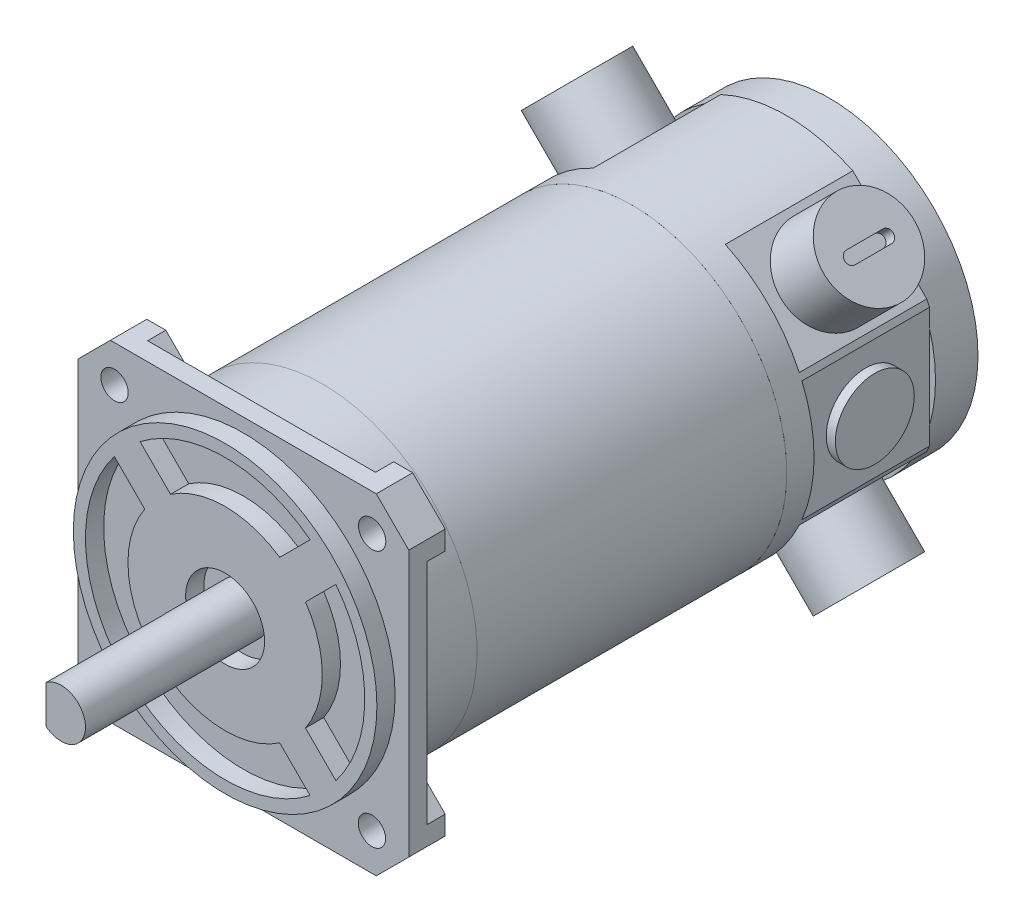
from build123d import *

# Parameters (mm, degrees)
SKETCH1_W            = 54.5
SKETCH1_H            = 54.5
BOSS_EXTRUDE1_DEPTH  = 3
SKETCH2_R            = 2.25
CUT_EXTRUDE1_DEPTH   = 3
SKETCH2_3_R          = 25
SKETCH2_3_R_2        = 23
SKETCH2_3_R_3        = 16
SKETCH2_3_R_4        = 6.5
BOSS_EXTRUDE2_DEPTH  = 3
SKETCH3_R            = 4
BOSS_EXTRUDE3_DEPTH  = 30
CUT_EXTRUDE2_DEPTH   = 20
SKETCH5_R            = 2.25
BOSS_EXTRUDE4_DEPTH  = 3
SKETCH5_3_R          = 25.5
SKETCH5_3_R_2        = 18.5
BOSS_EXTRUDE5_DEPTH  = 10
SKETCH6_R            = 25.5
SKETCH6_R_2          = 18.5
BOSS_EXTRUDE6_DEPTH  = 51
SKETCH7_R            = 18.5
BOSS_EXTRUDE7_DEPTH  = 4.5
BOSS_EXTRUDE8_START  = 4.5
SKETCH7_3_R          = 18.5
BOSS_EXTRUDE8_DEPTH  = 21
SKETCH8_R            = 24.5
BOSS_EXTRUDE9_DEPTH  = 7
SKETCH9_R            = 12.5
BOSS_EXTRUDE10_DEPTH = 8
SKETCH10_R           = 6.5
SKETCH10_R_2         = 3
CUT_EXTRUDE3_DEPTH   = 3
SKETCH10_2_R         = 3
BOSS_EXTRUDE11_DEPTH = 4
SKETCH11_R           = 7.5
BOSS_EXTRUDE12_DEPTH = 10
CUT_EXTRUDE4_DEPTH   = 2
CIRPATTERN2_COUNT    = 4
SKETCH13_R           = 8
BOSS_EXTRUDE13_DEPTH = 2
SKETCH14_R           = 6.5
BOSS_EXTRUDE14_DEPTH = 1.5


with BuildPart() as part:
    # Sketch1 → Boss-Extrude1 (new body)
    with BuildSketch(Plane.XY):
        Rectangle(SKETCH1_W, SKETCH1_H)
    extrude(amount=BOSS_EXTRUDE1_DEPTH)

    # Sketch2 → Cut-Extrude1 (cut)
    with BuildSketch(Plane.XY.offset(3)):
        Polygon((-27.25, 21.893921292), (-21.893921292, 27.25), (-27.25, 27.25), align=None)
        Polygon((27.25, 27.25), (21.893921292, 27.25), (27.25, 21.893921292), align=None)
        Polygon((-21.893921292, -27.25), (-27.25, -21.893921292), (-27.25, -27.25), align=None)
        Polygon((27.25, -27.25), (27.25, -21.893921292), (21.893921292, -27.25), align=None)
        with Locations((-21.213203436, -21.213203436)):
            Circle(SKETCH2_R)
        with Locations((21.175842801, -21.175842801)):
            Circle(SKETCH2_R)
        with Locations((21.213203436, 21.213203436)):
            Circle(SKETCH2_R)
        with Locations((-21.213203436, 21.213203436)):
            Circle(SKETCH2_R)
    extrude(amount=-CUT_EXTRUDE1_DEPTH, mode=Mode.SUBTRACT)

    # Sketch2<3> → Boss-Extrude2 (add)
    # profile 1 of 6: a face of its own
    with BuildSketch(Plane.XY.offset(3)):
        with Locations(Location((0, 0, 0), (0, 0, 180))):
            Circle(SKETCH2_3_R)
        Circle(SKETCH2_3_R_2, mode=Mode.SUBTRACT)
    # profile 2 of 6: a face of its own
    with BuildSketch(Plane.XY.offset(3)):
        Circle(SKETCH2_3_R_3)
        Circle(SKETCH2_3_R_4, mode=Mode.SUBTRACT)
    # profile 3 of 6: a face of its own
    with BuildSketch(Plane.XY.offset(3)):
        with BuildLine():
            Line((14.003195153, 18.24583584), (8.991735042, 13.234375729))
            ThreePointArc((8.991735042, 13.234375729), (11.313708499, 11.313708499), (13.234375729, 8.991735042))
            Line((13.234375729, 8.991735042), (18.24583584, 14.003195153))
            ThreePointArc((18.24583584, 14.003195153), (16.263455967, 16.263455967), (14.003195153, 18.24583584))
        make_face()
    # profile 4 of 6: a face of its own
    with BuildSketch(Plane.XY.offset(3)):
        with BuildLine():
            ThreePointArc((13.234375729, -8.991735042), (11.313708499, -11.313708499), (8.991735042, -13.234375729))
            Line((8.991735042, -13.234375729), (14.003195153, -18.24583584))
            ThreePointArc((14.003195153, -18.24583584), (16.263455967, -16.263455967), (18.24583584, -14.003195153))
            Line((18.24583584, -14.003195153), (13.234375729, -8.991735042))
        make_face()
    # profile 5 of 6: a face of its own
    with BuildSketch(Plane.XY.offset(3)):
        with BuildLine():
            ThreePointArc((-8.991735042, -13.234375729), (-11.313708499, -11.313708499), (-13.234375729, -8.991735042))
            Line((-13.234375729, -8.991735042), (-18.24583584, -14.003195153))
            ThreePointArc((-18.24583584, -14.003195153), (-16.263455967, -16.263455967), (-14.003195153, -18.24583584))
            Line((-14.003195153, -18.24583584), (-8.991735042, -13.234375729))
        make_face()
    # profile 6 of 6: a face of its own
    with BuildSketch(Plane.XY.offset(3)):
        with BuildLine():
            Line((-18.24583584, 14.003195153), (-13.234375729, 8.991735042))
            ThreePointArc((-13.234375729, 8.991735042), (-11.313708499, 11.313708499), (-8.991735042, 13.234375729))
            Line((-8.991735042, 13.234375729), (-14.003195153, 18.24583584))
            ThreePointArc((-14.003195153, 18.24583584), (-16.263455967, 16.263455967), (-18.24583584, 14.003195153))
        make_face()
    extrude(amount=BOSS_EXTRUDE2_DEPTH)

    # Sketch5 → Boss-Extrude4 (add)
    # profile 1 of 4: a face of its own
    with BuildSketch(Plane(origin=(0, 0, 0), x_dir=(-1, 0, 0), z_dir=(0, 0, -1))):
        with BuildLine():
            Line((21.893921292, 27.25), (18.764718626, 27.25))
            Line((18.764718626, 27.25), (13.282341481, 21.767622855))
            ThreePointArc((13.282341481, 21.767622855), (18.03122292, 18.03122292), (21.767622855, 13.282341481))
            Line((21.767622855, 13.282341481), (27.25, 18.764718626))
            Line((27.25, 18.764718626), (27.25, 21.893921292))
            Line((27.25, 21.893921292), (21.893921292, 27.25))
        make_face()
        with Locations(Location((21.213203436, 21.213203436, 0), (0, 0, 180))):
            Circle(SKETCH5_R, mode=Mode.SUBTRACT)
    # profile 2 of 4: a face of its own
    with BuildSketch(Plane(origin=(0, 0, 0), x_dir=(-1, 0, 0), z_dir=(0, 0, -1))):
        with BuildLine():
            Line((-13.282341481, 21.767622855), (-18.764718626, 27.25))
            Line((-18.764718626, 27.25), (-21.893921292, 27.25))
            Line((-21.893921292, 27.25), (-27.25, 21.893921292))
            Line((-27.25, 21.893921292), (-27.25, 18.764718626))
            Line((-27.25, 18.764718626), (-21.767622855, 13.282341481))
            ThreePointArc((-21.767622855, 13.282341481), (-18.03122292, 18.03122292), (-13.282341481, 21.767622855))
        make_face()
        with Locations(Location((-21.213203436, 21.213203436, 0), (0, 0, 180))):
            Circle(SKETCH5_R, mode=Mode.SUBTRACT)
    # profile 3 of 4: a face of its own
    with BuildSketch(Plane(origin=(0, 0, 0), x_dir=(-1, 0, 0), z_dir=(0, 0, -1))):
        with BuildLine():
            ThreePointArc((-13.282341481, -21.767622855), (-18.03122292, -18.03122292), (-21.767622855, -13.282341481))
            Line((-21.767622855, -13.282341481), (-27.25, -18.764718626))
            Line((-27.25, -18.764718626), (-27.25, -21.893921292))
            Line((-27.25, -21.893921292), (-21.893921292, -27.25))
            Line((-21.893921292, -27.25), (-18.764718626, -27.25))
            Line((-18.764718626, -27.25), (-13.282341481, -21.767622855))
        make_face()
        with Locations(Location((-21.175842801, -21.175842801, 0), (0, 0, 180))):
            Circle(SKETCH5_R, mode=Mode.SUBTRACT)
    # profile 4 of 4: a face of its own
    with BuildSketch(Plane(origin=(0, 0, 0), x_dir=(-1, 0, 0), z_dir=(0, 0, -1))):
        with BuildLine():
            Line((27.25, -21.893921292), (27.25, -18.764718626))
            Line((27.25, -18.764718626), (21.767622855, -13.282341481))
            ThreePointArc((21.767622855, -13.282341481), (18.03122292, -18.03122292), (13.282341481, -21.767622855))
            Line((13.282341481, -21.767622855), (18.764718626, -27.25))
            Line((18.764718626, -27.25), (21.893921292, -27.25))
            Line((21.893921292, -27.25), (27.25, -21.893921292))
        make_face()
        with Locations(Location((21.213203436, -21.213203436, 0), (0, 0, 180))):
            Circle(SKETCH5_R, mode=Mode.SUBTRACT)
    extrude(amount=BOSS_EXTRUDE4_DEPTH)

    # Sketch5<3> → Boss-Extrude5 (add)
    with BuildSketch(Plane(origin=(0, 0, 0), x_dir=(-1, 0, 0), z_dir=(0, 0, -1))):
        with Locations(Location((0, 0, 0), (0, 0, 148.608960631))):
            Circle(SKETCH5_3_R)
        Circle(SKETCH5_3_R_2, mode=Mode.SUBTRACT)
    extrude(amount=BOSS_EXTRUDE5_DEPTH)


with BuildPart() as body_2:
    # Sketch3 → Boss-Extrude3 (new body)
    with BuildSketch(Plane.XY.offset(3)):
        Circle(SKETCH3_R)
    extrude(amount=BOSS_EXTRUDE3_DEPTH)

    # Sketch4 → Cut-Extrude2 (cut)
    with BuildSketch(Plane.XY.offset(33)):
        with BuildLine():
            Line((-2.5, 3.122498999), (-2.5, -3.122498999))
            ThreePointArc((-2.5, -3.122498999), (-4, 0), (-2.5, 3.122498999))
        make_face()
    extrude(amount=-CUT_EXTRUDE2_DEPTH, mode=Mode.SUBTRACT)


with BuildPart() as body_3:
    # Sketch6 → Boss-Extrude6 (new body)
    with BuildSketch(Plane(origin=(0, 0, -10), x_dir=(-1, 0, 0), z_dir=(0, 0, -1))):
        Circle(SKETCH6_R)
        Circle(SKETCH6_R_2, mode=Mode.SUBTRACT)
    extrude(amount=BOSS_EXTRUDE6_DEPTH)


with BuildPart() as body_4:
    # Sketch7 → Boss-Extrude7 (new body)
    # profile 1 of 7: a face of its own
    with BuildSketch(Plane(origin=(0, 0, -61), x_dir=(-1, 0, 0), z_dir=(0, 0, -1))):
        with BuildLine():
            Line((-23.5, -9.899494937), (-23.5, 9.899494937))
            ThreePointArc((-23.5, 9.899494937), (-25.5, 0), (-23.5, -9.899494937))
        make_face()
    # profile 2 of 7: a face of its own
    with BuildSketch(Plane(origin=(0, 0, -61), x_dir=(-1, 0, 0), z_dir=(0, 0, -1))):
        with BuildLine():
            ThreePointArc((-10.877533945, 23.063591552), (-18.03122292, 18.03122292), (-23.063591552, 10.877533945))
            Line((-23.063591552, 10.877533945), (-10.877533945, 23.063591552))
        make_face()
    # profile 3 of 7: a face of its own
    with BuildSketch(Plane(origin=(0, 0, -61), x_dir=(-1, 0, 0), z_dir=(0, 0, -1))):
        with BuildLine():
            ThreePointArc((23.063591552, 10.877533945), (18.03122292, 18.03122292), (10.877533945, 23.063591552))
            Line((10.877533945, 23.063591552), (23.063591552, 10.877533945))
        make_face()
    # profile 4 of 7: a face of its own
    with BuildSketch(Plane(origin=(0, 0, -61), x_dir=(-1, 0, 0), z_dir=(0, 0, -1))):
        with BuildLine():
            ThreePointArc((25.5, 0), (24.9949995, 5.049752469), (23.5, 9.899494937))
            Line((23.5, 9.899494937), (23.5, -9.899494937))
            ThreePointArc((23.5, -9.899494937), (24.9949995, -5.049752469), (25.5, 0))
        make_face()
    # profile 5 of 7: a face of its own
    with BuildSketch(Plane(origin=(0, 0, -61), x_dir=(-1, 0, 0), z_dir=(0, 0, -1))):
        with BuildLine():
            Line((23.063591552, -10.877533945), (10.877533945, -23.063591552))
            ThreePointArc((10.877533945, -23.063591552), (18.03122292, -18.03122292), (23.063591552, -10.877533945))
        make_face()
    # profile 6 of 7: a face of its own
    with BuildSketch(Plane(origin=(0, 0, -61), x_dir=(-1, 0, 0), z_dir=(0, 0, -1))):
        with BuildLine():
            Line((-10.877533945, -23.063591552), (-23.063591552, -10.877533945))
            ThreePointArc((-23.063591552, -10.877533945), (-18.03122292, -18.03122292), (-10.877533945, -23.063591552))
        make_face()
    # profile 7 of 7: a face of its own
    with BuildSketch(Plane(origin=(0, 0, -61), x_dir=(-1, 0, 0), z_dir=(0, 0, -1))):
        with BuildLine():
            ThreePointArc((-23.063591552, 10.877533945), (-23.286930983, 10.390805809), (-23.5, 9.899494937))
            Line((-23.5, 9.899494937), (-23.5, -9.899494937))
            ThreePointArc((-23.5, -9.899494937), (-23.286930983, -10.390805809), (-23.063591552, -10.877533945))
            Line((-23.063591552, -10.877533945), (-10.877533945, -23.063591552))
            ThreePointArc((-10.877533945, -23.063591552), (0, -25.5), (10.877533945, -23.063591552))
            Line((10.877533945, -23.063591552), (23.063591552, -10.877533945))
            ThreePointArc((23.063591552, -10.877533945), (23.286930983, -10.390805809), (23.5, -9.899494937))
            Line((23.5, -9.899494937), (23.5, 9.899494937))
            ThreePointArc((23.5, 9.899494937), (23.286930983, 10.390805809), (23.063591552, 10.877533945))
            Line((23.063591552, 10.877533945), (10.877533945, 23.063591552))
            ThreePointArc((10.877533945, 23.063591552), (0, 25.5), (-10.877533945, 23.063591552))
            Line((-10.877533945, 23.063591552), (-23.063591552, 10.877533945))
        make_face()
        Circle(SKETCH7_R, mode=Mode.SUBTRACT)
    extrude(amount=BOSS_EXTRUDE7_DEPTH)

    # Sketch7<3> → Boss-Extrude8 (add)
    with BuildSketch(Plane(origin=(0, 0, -61), x_dir=(-1, 0, 0), z_dir=(0, 0, -1)).offset(BOSS_EXTRUDE8_START)):
        with BuildLine():
            ThreePointArc((-23.063591552, 10.877533945), (-23.286930983, 10.390805809), (-23.5, 9.899494937))
            Line((-23.5, 9.899494937), (-23.5, -9.899494937))
            ThreePointArc((-23.5, -9.899494937), (-23.286930983, -10.390805809), (-23.063591552, -10.877533945))
            Line((-23.063591552, -10.877533945), (-10.877533945, -23.063591552))
            ThreePointArc((-10.877533945, -23.063591552), (0, -25.5), (10.877533945, -23.063591552))
            Line((10.877533945, -23.063591552), (23.063591552, -10.877533945))
            ThreePointArc((23.063591552, -10.877533945), (23.286930983, -10.390805809), (23.5, -9.899494937))
            Line((23.5, -9.899494937), (23.5, 9.899494937))
            ThreePointArc((23.5, 9.899494937), (23.286930983, 10.390805809), (23.063591552, 10.877533945))
            Line((23.063591552, 10.877533945), (10.877533945, 23.063591552))
            ThreePointArc((10.877533945, 23.063591552), (0, 25.5), (-10.877533945, 23.063591552))
            Line((-10.877533945, 23.063591552), (-23.063591552, 10.877533945))
        make_face()
        Circle(SKETCH7_3_R, mode=Mode.SUBTRACT)
    extrude(amount=BOSS_EXTRUDE8_DEPTH)

    # Sketch8 → Boss-Extrude9 (add)
    with BuildSketch(Plane(origin=(0, 0, -86.5), x_dir=(-1, 0, 0), z_dir=(0, 0, -1))):
        with Locations(Location((0, 0, 0), (0, 0, 163.573578597))):
            Circle(SKETCH8_R)
    extrude(amount=BOSS_EXTRUDE9_DEPTH)

    # Sketch9 → Boss-Extrude10 (add)
    with BuildSketch(Plane(origin=(0, 0, -93.5), x_dir=(-1, 0, 0), z_dir=(0, 0, -1))):
        Circle(SKETCH9_R)
    extrude(amount=BOSS_EXTRUDE10_DEPTH)

    # Sketch10 → Cut-Extrude3 (cut)
    with BuildSketch(Plane(origin=(0, 0, -101.5), x_dir=(-1, 0, 0), z_dir=(0, 0, -1))):
        Circle(SKETCH10_R)
        Circle(SKETCH10_R_2, mode=Mode.SUBTRACT)
    extrude(amount=-CUT_EXTRUDE3_DEPTH, mode=Mode.SUBTRACT)

    # Sketch10<2> → Boss-Extrude11 (add)
    with BuildSketch(Plane(origin=(0, 0, -101.5), x_dir=(-1, 0, 0), z_dir=(0, 0, -1))):
        Circle(SKETCH10_2_R)
    extrude(amount=BOSS_EXTRUDE11_DEPTH)


with BuildPart() as body_5:
    # Sketch11 → Boss-Extrude12 (new body)
    with BuildSketch(Plane(origin=(16.970562748, -16.970562748, 0), x_dir=(0, 0, -1), z_dir=(0.7071067811865477, -0.7071067811865475, 0))):
        with Locations(Location((76, 0, 0), (0, 0, 90))):
            Circle(SKETCH11_R)
    boss_extrude12 = extrude(amount=BOSS_EXTRUDE12_DEPTH)

    # Sketch12 → Cut-Extrude4 (cut)
    with BuildSketch(Plane(origin=(24.04163056, -24.04163056, 0), x_dir=(0, 0, -1), z_dir=(0.7071067811865476, -0.7071067811865476, 0))):
        with BuildLine():
            Line((79, -1), (73, -1))
            ThreePointArc((73, -1), (72, 0), (73, 1))
            Line((73, 1), (79, 1))
            ThreePointArc((79, 1), (80, 0), (79, -1))
        make_face()
    cut_extrude4 = extrude(amount=-CUT_EXTRUDE4_DEPTH, mode=Mode.SUBTRACT)


with BuildPart() as body_4_1:
    add(body_4.part)

    # CirPattern2: Boss-Extrude12, Cut-Extrude4 ×4 about axis
    cirpattern2_axis = Axis((0, 0, 0), (0, 0, 1))
    add([boss_extrude12.rotate(cirpattern2_axis, i * 360 / CIRPATTERN2_COUNT) for i in range(1, CIRPATTERN2_COUNT)])
    add([cut_extrude4.rotate(cirpattern2_axis, i * 360 / CIRPATTERN2_COUNT) for i in range(1, CIRPATTERN2_COUNT)], mode=Mode.SUBTRACT)


with BuildPart() as body_6:
    # Sketch13 → Boss-Extrude13 (new body)
    with BuildSketch(Plane.ZY.offset(23.5)):
        with Locations((-76, 0)):
            Circle(SKETCH13_R)
    extrude(amount=BOSS_EXTRUDE13_DEPTH)


with BuildPart() as body_7:
    # Sketch14 → Boss-Extrude14 (new body)
    with BuildSketch(Plane(origin=(23.5, 0, 0), x_dir=(0, 0, -1), z_dir=(1, 0, 0))):
        with Locations((76, 0)):
            Circle(SKETCH14_R)
    extrude(amount=BOSS_EXTRUDE14_DEPTH)


solid = Compound([part.part, body_2.part, body_3.part, body_5.part, body_4_1.part, body_6.part, body_7.part])
